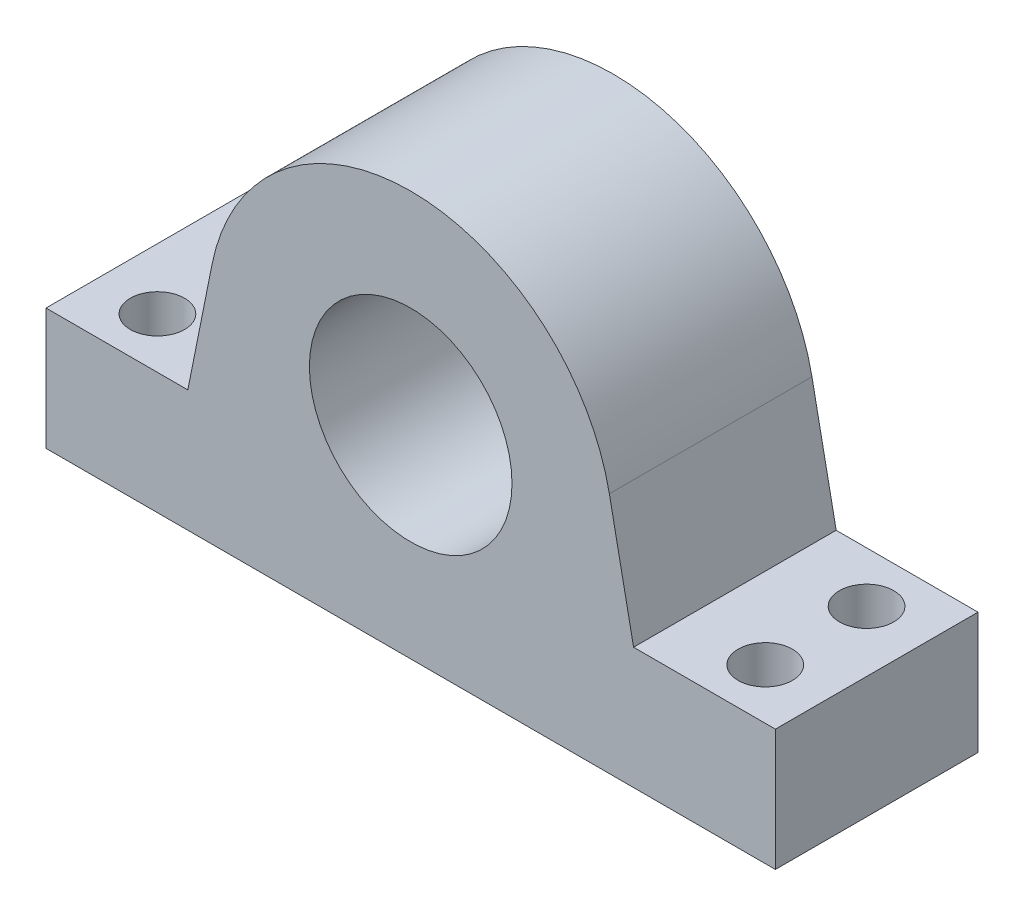
from build123d import *

# Parameters (mm, degrees)
SKETCH1_R                                  = 6.35
BOSS_EXTRUDE1_DEPTH                        = 6.35
SKETCH2_R                                  = 1.7018
CUT_EXTRUDE1_DEPTH                         = 30.648448526
MIRROR1_AT_THE_SECOND_PLANE_COPY_1_SKETC_R = 1.7018
MIRROR1_AT_THE_SECOND_PLANE_COPY_1_DEPTH   = 30.648448526


with BuildPart() as part:
    # Sketch1 → Boss-Extrude1 (new, symmetric)
    with BuildSketch(Plane.XY):
        with BuildLine():
            Line((-12.452586398, 2.494612595), (-13.97, -5.08))
            Line((-13.97, -5.08), (-22.86, -5.08))
            Line((-22.86, -5.08), (-22.86, -12.7))
            Line((-22.86, -12.7), (22.86, -12.7))
            Line((22.86, -12.7), (22.86, -5.08))
            Line((22.86, -5.08), (13.97, -5.08))
            Line((13.97, -5.08), (12.452586398, 2.494612595))
            ThreePointArc((12.452586398, 2.494612595), (0, 12.7), (-12.452586398, 2.494612595))
        make_face()
        Circle(SKETCH1_R, mode=Mode.SUBTRACT)
    extrude(amount=BOSS_EXTRUDE1_DEPTH, both=True)

    # Sketch2 → Cut-Extrude1 (cut, through all)
    with BuildSketch(Plane(origin=(0, -5.08, 0), x_dir=(1, 0, 0), z_dir=(0, 1, 0))):
        with Locations(Location((-19.05, 3.175, 0), (0, 0, 270))):
            Circle(SKETCH2_R)
    cut_extrude1 = extrude(amount=-CUT_EXTRUDE1_DEPTH, mode=Mode.SUBTRACT)

    # Mirror1: Cut-Extrude1 across plane
    add(cut_extrude1.mirror(Plane(origin=(0, 0, 0), x_dir=(0, 0, 1), z_dir=(1, 0, 0))), mode=Mode.SUBTRACT)

    # Mirror1 at the second plane: Cut-Extrude1 across plane
    add(cut_extrude1.mirror(Plane.XY), mode=Mode.SUBTRACT)

    # Mirror1 at the second plane copy 1 sketc → Mirror1 at the second plane copy 1 (cut, through all)
    with BuildSketch(Plane(origin=(0, -5.08, 0), x_dir=(-1, 0, 0), z_dir=(0, 1, 0))):
        with Locations(Location((-19.05, 3.175, 0), (0, 0, 270))):
            Circle(MIRROR1_AT_THE_SECOND_PLANE_COPY_1_SKETC_R)
    extrude(amount=-MIRROR1_AT_THE_SECOND_PLANE_COPY_1_DEPTH, mode=Mode.SUBTRACT)


solid = part.part
